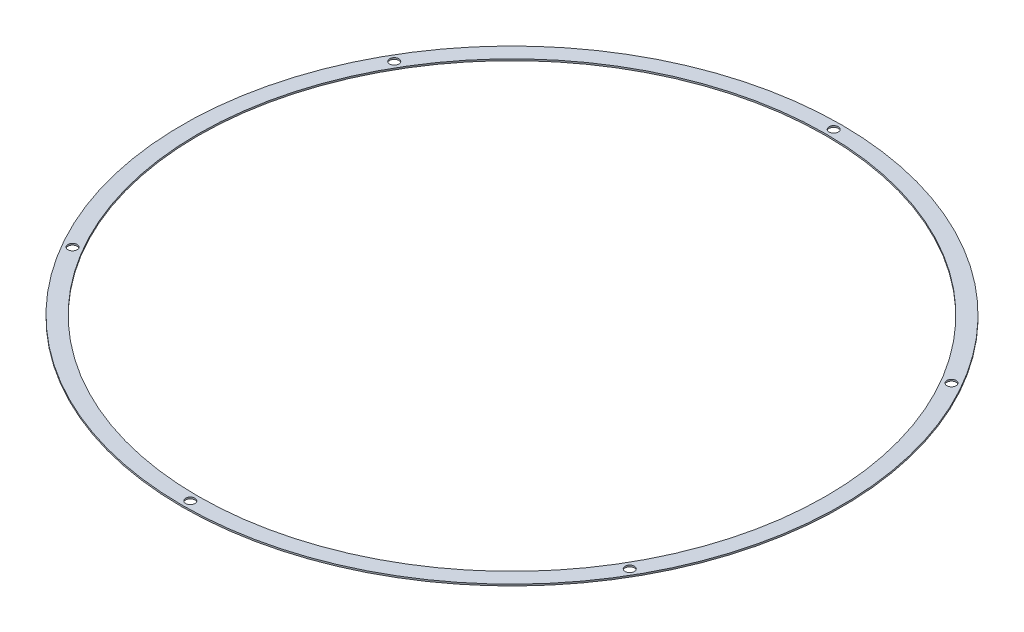
from build123d import *

# Parameters (mm, degrees)
SKETCH1_R           = 105
SKETCH1_R_2         = 1.4732
SKETCH1_R_3         = 100
BOSS_EXTRUDE1_DEPTH = 0.508


with BuildPart() as part:
    # Sketch1 → Boss-Extrude1 (new body)
    with BuildSketch(Plane(origin=(0, 0, 0), x_dir=(1, 0, 0), z_dir=(0, 1, 0))):
        with Locations(Location((0, 0, 0), (0, 0, 270))):
            Circle(SKETCH1_R)
        with Locations(Location((88.768103888, -51.250866025, 0), (0, 0, 270))):
            Circle(SKETCH1_R_2, mode=Mode.SUBTRACT)
        with Locations(Location((88.769103888, 51.249133975, 0), (0, 0, 270))):
            Circle(SKETCH1_R_2, mode=Mode.SUBTRACT)
        with Locations(Location((0.002, 102.5, 0), (0, 0, 270))):
            Circle(SKETCH1_R_2, mode=Mode.SUBTRACT)
        with Locations(Location((-88.766103888, 51.250866025, 0), (0, 0, 270))):
            Circle(SKETCH1_R_2, mode=Mode.SUBTRACT)
        with Locations(Location((-88.767103888, -51.249133975, 0), (0, 0, 270))):
            Circle(SKETCH1_R_2, mode=Mode.SUBTRACT)
        with Locations(Location((0, -102.5, 0), (0, 0, 270))):
            Circle(SKETCH1_R_2, mode=Mode.SUBTRACT)
        with Locations(Location((0, 0, 0), (0, 0, 270))):
            Circle(SKETCH1_R_3, mode=Mode.SUBTRACT)
    extrude(amount=BOSS_EXTRUDE1_DEPTH)


solid = part.part
